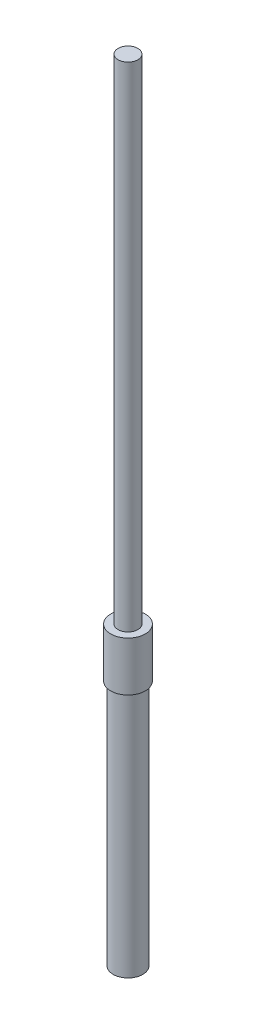
from build123d import *

# Parameters (mm, degrees)
SKETCH1_R        = 3
STEEL_TUBE_DEPTH = 50
HEATSHRINK_START = 50
SKETCH2_R        = 3.5
HEATSHRINK_DEPTH = 10
CABLE_START      = 60
SKETCH3_R        = 2
CABLE_DEPTH      = 100


with BuildPart() as part:
    # Sketch1 → Steel_Tube (new body)
    with BuildSketch(Plane(origin=(0, 0, 0), x_dir=(1, 0, 0), z_dir=(0, 1, 0))):
        with Locations(Location((0, 0, 0), (0, 0, 270))):
            Circle(SKETCH1_R)
    extrude(amount=STEEL_TUBE_DEPTH)

    # Sketch2 → Heatshrink (add)
    with BuildSketch(Plane(origin=(0, 0, 0), x_dir=(1, 0, 0), z_dir=(0, 1, 0)).offset(HEATSHRINK_START)):
        with Locations(Location((0, 0, 0), (0, 0, 270))):
            Circle(SKETCH2_R)
    extrude(amount=HEATSHRINK_DEPTH)

    # Sketch3 → Cable (add)
    with BuildSketch(Plane(origin=(0, 0, 0), x_dir=(1, 0, 0), z_dir=(0, 1, 0)).offset(CABLE_START)):
        with Locations(Location((0, 0, 0), (0, 0, 270))):
            Circle(SKETCH3_R)
    extrude(amount=CABLE_DEPTH)


solid = part.part
